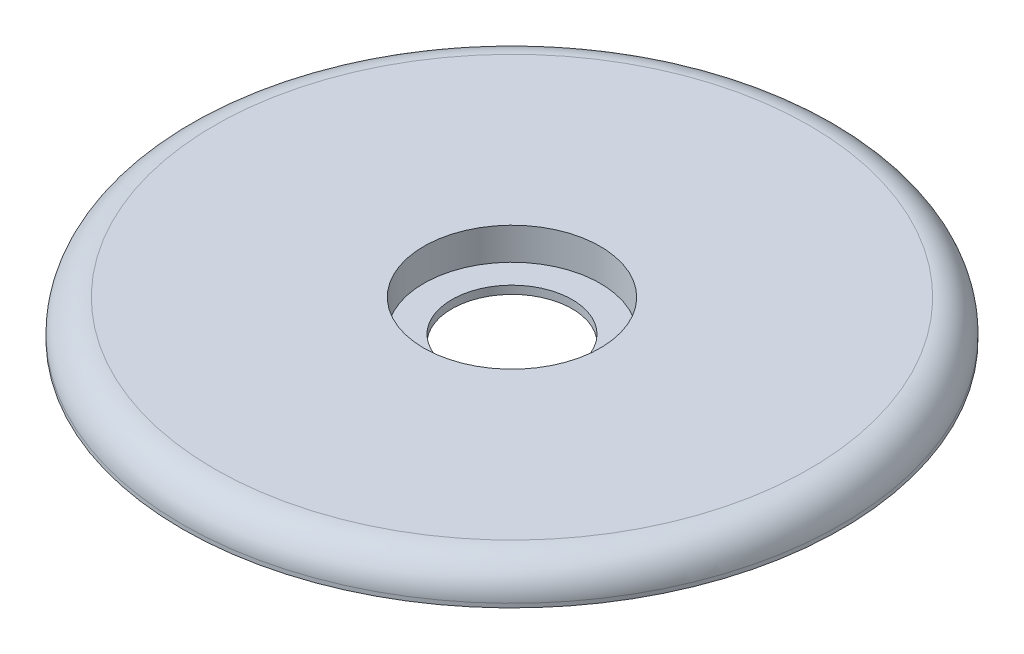
from build123d import *

# Parameters (mm, degrees)
SKETCH1_R           = 41.1
BOSS_EXTRUDE1_DEPTH = 4.5
SKETCH5_R           = 38.4
BOSS_EXTRUDE3_DEPTH = 0.5
SKETCH2_R           = 11
SKETCH2_R_2         = 4.5
CUT_EXTRUDE1_DEPTH  = 4
SKETCH3_R           = 7.5
CUT_EXTRUDE2_DEPTH  = 59.261651195
FILLET1_R           = 4


with BuildPart() as part:
    # Sketch1 → Boss-Extrude1 (new body)
    with BuildSketch(Plane(origin=(0, 0, 0), x_dir=(1, 0, 0), z_dir=(0, 1, 0))):
        with Locations(Location((0, 0, 0), (0, 0, 270))):
            Circle(SKETCH1_R)
    extrude(amount=BOSS_EXTRUDE1_DEPTH)

    # Sketch5 → Boss-Extrude3 (add)
    with BuildSketch(Plane.XZ):
        with Locations(Location((0, 0, 0), (0, 0, 270))):
            Circle(SKETCH5_R)
    extrude(amount=BOSS_EXTRUDE3_DEPTH)

    # Sketch2 → Cut-Extrude1 (cut)
    # profile 1 of 2: a face of its own
    with BuildSketch(Plane(origin=(0, 4.5, 0), x_dir=(1, 0, 0), z_dir=(0, 1, 0))):
        with Locations(Location((0, 0, 0), (0, 0, 270))):
            Circle(SKETCH2_R)
        Circle(SKETCH2_R_2, mode=Mode.SUBTRACT)
    # profile 2 of 2: a face of its own
    with BuildSketch(Plane(origin=(0, 4.5, 0), x_dir=(1, 0, 0), z_dir=(0, 1, 0))):
        Circle(SKETCH2_R_2)
    extrude(amount=-CUT_EXTRUDE1_DEPTH, mode=Mode.SUBTRACT)

    # Sketch3 → Cut-Extrude2 (cut, through all)
    with BuildSketch(Plane(origin=(0, 0.5, 0), x_dir=(1, 0, 0), z_dir=(0, 1, 0))):
        with Locations(Location((0, 0, 0), (0, 0, 270))):
            Circle(SKETCH3_R)
    extrude(amount=-CUT_EXTRUDE2_DEPTH, mode=Mode.SUBTRACT)

    # Fillet1
    fillet1_edges = [part.edges().sort_by_distance(p)[0] for p in [
        (0, 4.5, -41.1),
    ]]
    fillet(fillet1_edges, radius=FILLET1_R)


solid = part.part
